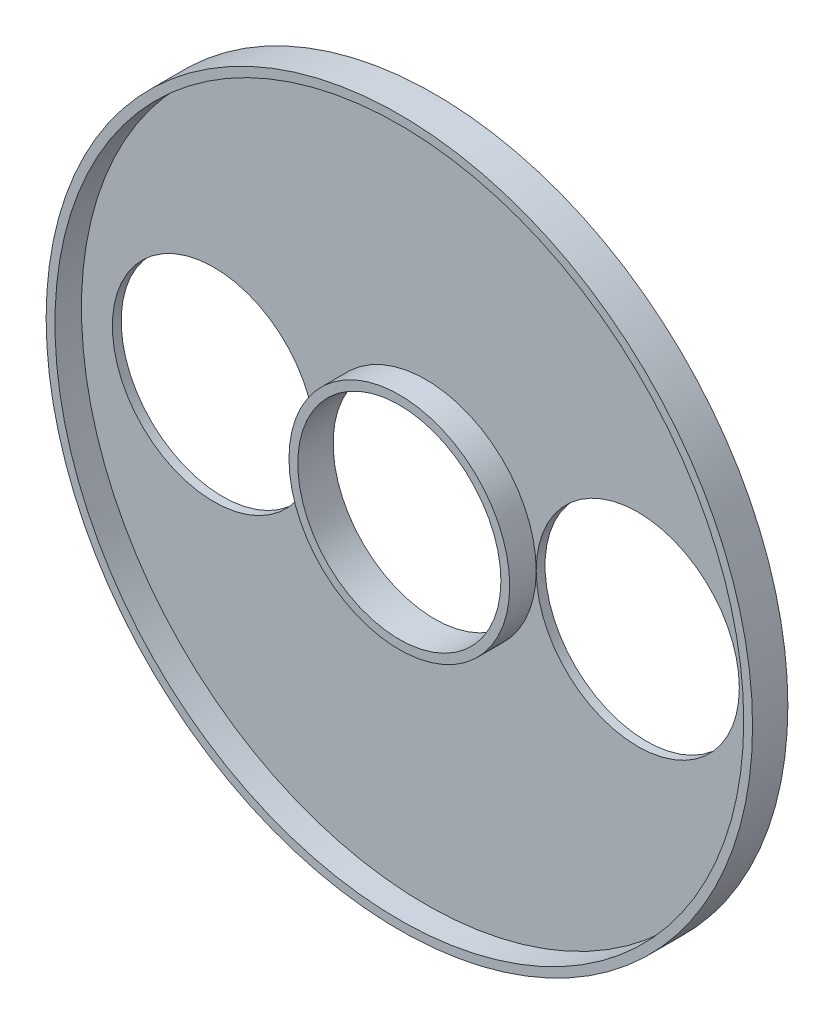
from build123d import *

# Parameters (mm, degrees)
PLENUM_BACKPLATE_START  = -52
SKETCH_1_R              = 80
SKETCH_1_R_2            = 23
PLENUM_BACKPLATE_DEPTH  = 2
PLENUM_OUTER_WALL_START = -52
SKETCH_2_R              = 80
SKETCH_2_R_2            = 78
PLENUM_OUTER_WALL_DEPTH = 8
PLENUM_INNER_WALL_START = -52
SKETCH_3_R              = 25
SKETCH_3_R_2            = 23
PLENUM_INNER_WALL_DEPTH = 8
SKETCH_4_R              = 23
THROUGH_HOLES_DEPTH     = 100


with BuildPart() as part:
    # Эскиз1 → Plenum_backplate (new body)
    with BuildSketch(Plane.XY.offset(PLENUM_BACKPLATE_START)):
        Circle(SKETCH_1_R)
        Circle(SKETCH_1_R_2, mode=Mode.SUBTRACT)
    extrude(amount=PLENUM_BACKPLATE_DEPTH)

    # Эскиз2 → Plenum_outer_wall (add)
    with BuildSketch(Plane.XY.offset(PLENUM_OUTER_WALL_START)):
        Circle(SKETCH_2_R)
        Circle(SKETCH_2_R_2, mode=Mode.SUBTRACT)
    extrude(amount=PLENUM_OUTER_WALL_DEPTH)

    # Эскиз3 → Plenum_inner_wall (add)
    with BuildSketch(Plane.XY.offset(PLENUM_INNER_WALL_START)):
        Circle(SKETCH_3_R)
        Circle(SKETCH_3_R_2, mode=Mode.SUBTRACT)
    extrude(amount=PLENUM_INNER_WALL_DEPTH)

    # Эскиз4 → Through_holes (cut, symmetric)
    with BuildSketch(Plane.XY):
        with Locations((-48, 0)):
            Circle(SKETCH_4_R)
        with Locations((48, 0)):
            Circle(SKETCH_4_R)
    extrude(amount=THROUGH_HOLES_DEPTH, both=True, mode=Mode.SUBTRACT)


solid = part.part
